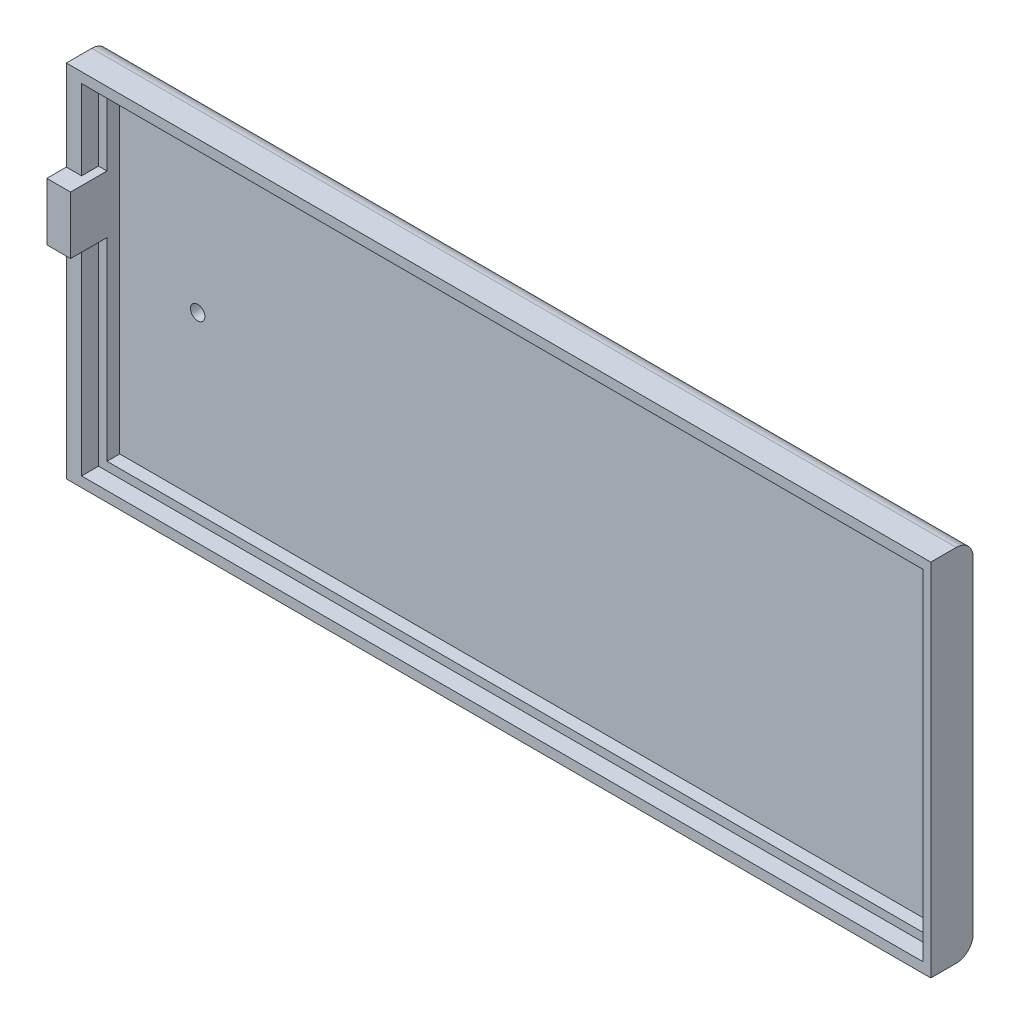
from build123d import *

# Parameters (mm, degrees)
SKETCH2_W           = 102
SKETCH2_H           = 42.5
BOSS_EXTRUDE1_DEPTH = 5
SKETCH3_W           = 97.3
SKETCH3_H           = 38.1
CUT_EXTRUDE1_DEPTH  = 3.5
SKETCH4_W           = 2.8
SKETCH4_H           = 6.8
BOSS_EXTRUDE3_DEPTH = 2.3
CUT_EXTRUDE4_DEPTH  = 2
SKETCH9_R           = 0.85
CUT_EXTRUDE5_DEPTH  = 31
FILLET1_R           = 2


with BuildPart() as part:
    # Sketch2 → Boss-Extrude1 (new body)
    with BuildSketch(Plane.XY):
        with Locations((51, 21.25)):
            Rectangle(SKETCH2_W, SKETCH2_H)
    extrude(amount=BOSS_EXTRUDE1_DEPTH)

    # Sketch3 → Cut-Extrude1 (cut)
    with BuildSketch(Plane.XY.offset(5)):
        with Locations((51.45, 21.25)):
            Rectangle(SKETCH3_W, SKETCH3_H)
    extrude(amount=-CUT_EXTRUDE1_DEPTH, mode=Mode.SUBTRACT)

    # Sketch4 → Boss-Extrude3 (add)
    with BuildSketch(Plane.XY.offset(5)):
        with Locations((1.4, 28.4635072)):
            Rectangle(SKETCH4_W, SKETCH4_H)
    extrude(amount=BOSS_EXTRUDE3_DEPTH)

    # Sketch8 → Cut-Extrude4 (cut)
    with BuildSketch(Plane.XY.offset(5)):
        Polygon((2.8, 31.8635072), (1.8, 31.8635072), (1.8, 41.3), (101.1, 41.3), (101.1, 1.2), (1.8, 1.2), (1.8, 25.0635072), (2.8, 25.0635072), (2.8, 2.2), (100.1, 2.2), (100.1, 40.3), (2.8, 40.3), align=None)
    extrude(amount=-CUT_EXTRUDE4_DEPTH, mode=Mode.SUBTRACT)

    # Sketch9 → Cut-Extrude5 (cut)
    with BuildSketch(Plane.XY.offset(1.5)):
        with Locations((12, 21.25)):
            Circle(SKETCH9_R)
    extrude(amount=-CUT_EXTRUDE5_DEPTH, mode=Mode.SUBTRACT)

    # Fillet1
    fillet1_edges = [part.edges().sort_by_distance(p)[0] for p in [
        (51, 42.5, 0),
        (51, 0, 0),
    ]]
    fillet(fillet1_edges, radius=FILLET1_R)


solid = part.part
